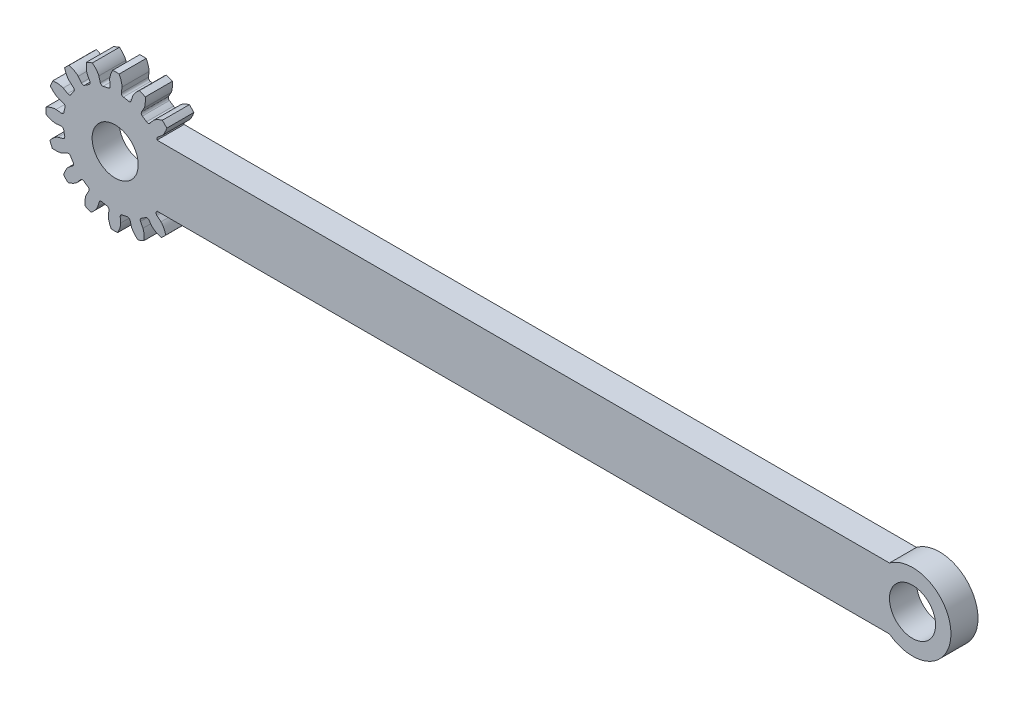
from build123d import *

# Parameters (mm, degrees)
BOSS_EXTRUDE1_DEPTH      = 5.588
CUT_EXTRUDE1_DEPTH       = 174.299858936
FILLET1_R                = 0.496244564
CIRPATTERN1_COUNT        = 16
FILLET1_OF_CIRPATTERN1_R = 0.496244564
SKETCH4_W                = 5.588
SKETCH4_H                = 12.7
BOSS_EXTRUDE2_DEPTH      = 5.08
SKETCH5_R                = 4.7625
CUT_EXTRUDE2_DEPTH       = 174.299859047


with BuildPart() as part:
    # Sketch1 → Boss-Extrude1 (new body)
    with BuildSketch(Plane.XY):
        with BuildLine():
            Line((12.798834175, -6.35), (159.919473719, -6.35))
            ThreePointArc((159.919473719, -6.35), (172.619473719, 0), (159.919473719, 6.35))
            Line((159.919473719, 6.35), (12.798834175, 6.35))
            ThreePointArc((12.798834175, 6.35), (-14.2875, 0), (12.798834175, -6.35))
        make_face()
    extrude(amount=BOSS_EXTRUDE1_DEPTH)

    # Sketch3 → Cut-Extrude1 (cut, through all)
    with BuildSketch(Plane.XY.offset(5.588)):
        with BuildLine():
            Line((10.304535783, 2.93958525), (11.823777189, 3.372980769))
            add(Edge.make_bspline(
                [(11.823777189, 3.372980769), (11.826828122, 3.373892569), (11.835350142, 3.376568337), (11.851321191, 3.382094065), (11.877172543, 3.391770902), (11.909795337, 3.405068504), (11.951582688, 3.42336192), (12.000307705, 3.446328962), (12.053311702, 3.473046741), (12.110372018, 3.503701368), (12.166747224, 3.535680762), (12.222457493, 3.568875739), (12.277469218, 3.603106176), (12.343518338, 3.645937307), (12.421890668, 3.699191843), (12.51225172, 3.764180094), (12.613236283, 3.84110705), (12.714502029, 3.922921917), (12.812770185, 4.006222816), (12.910423586, 4.093569134), (13.00374758, 4.180333952), (13.098951244, 4.273675723), (13.185952071, 4.361475552), (13.28145445, 4.463366885), (13.35795476, 4.546626366), (13.435301406, 4.635544323), (13.472697325, 4.679249473), (13.491703323, 4.70176538)],
                knots=[0, 0, 0, 0, 0, 0.005376749, 0.015083688, 0.02853182, 0.04661014, 0.064854849, 0.092110526, 0.119476176, 0.146842496, 0.174208854, 0.201574956, 0.228941013, 0.256307345, 0.307035032, 0.361767352, 0.416499661, 0.471231937, 0.525964282, 0.580696616, 0.635428982, 0.690161387, 0.744893688, 0.799626082, 0.854358407, 0.909090915, 0.909090915, 0.909090915, 0.909090915, 0.909090915], degree=4))
            ThreePointArc((13.491703323, 4.70176538), (14.043018272, 2.631785339), (14.278655565, 0.502644525))
            add(Edge.make_bspline(
                [(12.242763285, 1.137300936), (12.245937342, 1.137555753), (12.254849948, 1.138147388), (12.271738056, 1.138779756), (12.299339098, 1.139120368), (12.334563147, 1.138537862), (12.380138823, 1.136617047), (12.433873689, 1.132851889), (12.492955303, 1.127139941), (12.557243503, 1.119227096), (12.621372784, 1.109831304), (12.685322412, 1.099061646), (12.748995841, 1.087073853), (12.826071969, 1.071065653), (12.918409361, 1.049803624), (13.026170688, 1.021945252), (13.148157611, 0.986805116), (13.272176548, 0.947210583), (13.393939406, 0.905145435), (13.516594072, 0.85908679), (13.635002567, 0.812002506), (13.757544691, 0.759468213), (13.87043389, 0.709129536), (13.996350253, 0.648734026), (14.097807449, 0.59882535), (14.202102483, 0.543948644), (14.252786319, 0.516750416), (14.278655565, 0.502644525)],
                knots=[0, 0, 0, 0, 0, 0.005376749, 0.015083688, 0.02853182, 0.04661014, 0.064854849, 0.092110526, 0.119476176, 0.146842496, 0.174208854, 0.201574956, 0.228941013, 0.256307345, 0.307035032, 0.361767352, 0.416499661, 0.471231937, 0.525964282, 0.580696616, 0.635428982, 0.690161387, 0.744893688, 0.799626082, 0.854358407, 0.909090915, 0.909090915, 0.909090915, 0.909090915, 0.909090915], degree=4))
            Line((12.242763285, 1.137300936), (10.669686204, 0.991168727))
            ThreePointArc((10.669686204, 0.991168727), (10.532263704, 1.973839004), (10.304535783, 2.93958525))
        make_face()
    cut_extrude1 = extrude(amount=-CUT_EXTRUDE1_DEPTH, mode=Mode.SUBTRACT)

    # Fillet1
    fillet1_edges = [part.edges().sort_by_distance(p)[0] for p in [
        (10.669686204, 0.991168727, 2.794),
        (10.304535783, 2.93958525, 2.794),
    ]]
    fillet(fillet1_edges, radius=FILLET1_R)

    # CirPattern1: Cut-Extrude1 ×16 about axis
    cirpattern1_axis = Axis((0, 0, 5.588), (0, 0, 1))
    for i in range(1, CIRPATTERN1_COUNT):
        add(cut_extrude1.rotate(cirpattern1_axis, i * 360 / CIRPATTERN1_COUNT), mode=Mode.SUBTRACT)

    # Fillet1 of CirPattern1
    fillet1_of_cirpattern1_edges = [part.edges().sort_by_distance(p)[0] for p in [
        (9.478200852, 4.998832639, 2.794),
        (8.395219128, 6.659197769, 2.794),
        (6.84374534, 8.245469596, 2.794),
        (5.207806465, 9.365007793, 2.794),
        (3.167391638, 10.236808553, 2.794),
        (1.227552476, 10.645080275, 2.794),
        (-0.991168727, 10.669686204, 2.794),
        (-2.93958525, 10.304535783, 2.794),
        (-4.998832639, 9.478200852, 2.794),
        (-6.659197769, 8.395219128, 2.794),
        (-8.245469596, 6.84374534, 2.794),
        (-9.365007793, 5.207806465, 2.794),
        (-10.236808553, 3.167391638, 2.794),
        (-10.645080275, 1.227552476, 2.794),
        (-10.669686204, -0.991168727, 2.794),
        (-10.304535783, -2.93958525, 2.794),
        (-9.478200852, -4.998832639, 2.794),
        (-8.395219128, -6.659197769, 2.794),
        (-6.84374534, -8.245469596, 2.794),
        (-5.207806465, -9.365007793, 2.794),
        (-3.167391638, -10.236808553, 2.794),
        (-1.227552476, -10.645080275, 2.794),
        (0.991168727, -10.669686204, 2.794),
        (2.93958525, -10.304535783, 2.794),
        (4.998832639, -9.478200852, 2.794),
        (6.659197769, -8.395219128, 2.794),
        (8.245469596, -6.84374534, 2.794),
        (9.365007793, -5.207806465, 2.794),
        (10.236808553, -3.167391638, 2.794),
        (10.645080275, -1.227552476, 2.794),
    ]]
    fillet(fillet1_of_cirpattern1_edges, radius=FILLET1_OF_CIRPATTERN1_R)

    # Sketch4 → Boss-Extrude2 (add, symmetric)
    with BuildSketch(Plane(origin=(10.16, 0, 0), x_dir=(0, 0, -1), z_dir=(1, 0, 0))):
        with Locations((-2.794, 0)):
            Rectangle(SKETCH4_W, SKETCH4_H)
    extrude(amount=BOSS_EXTRUDE2_DEPTH, both=True)

    # Sketch5 → Cut-Extrude2 (cut, through all)
    with BuildSketch(Plane.XY.offset(5.588)):
        Circle(SKETCH5_R)
        with Locations((164.681973719, 0)):
            Circle(SKETCH5_R)
    extrude(amount=-CUT_EXTRUDE2_DEPTH, mode=Mode.SUBTRACT)


solid = part.part
